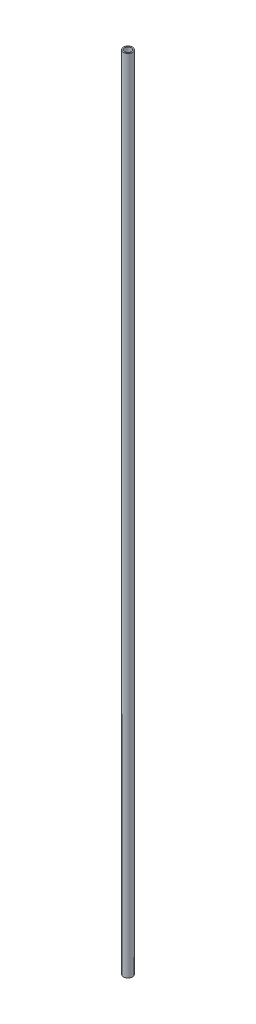
from build123d import *

# Parameters (mm, degrees)
SZKIC1_R                    = 4
SZKIC1_R_2                  = 3
DODANIE_WYCI_GNI_CIE1_DEPTH = 700


with BuildPart() as part:
    # Szkic1 → Dodanie-wyciągnięcie1 (new body)
    with BuildSketch(Plane(origin=(0, 0, 0), x_dir=(1, 0, 0), z_dir=(0, 1, 0))):
        with Locations(Location((0, 0, 0), (0, 0, 270))):
            Circle(SZKIC1_R)
        with Locations(Location((0, 0, 0), (0, 0, 270))):
            Circle(SZKIC1_R_2, mode=Mode.SUBTRACT)
    extrude(amount=DODANIE_WYCI_GNI_CIE1_DEPTH)


solid = part.part
